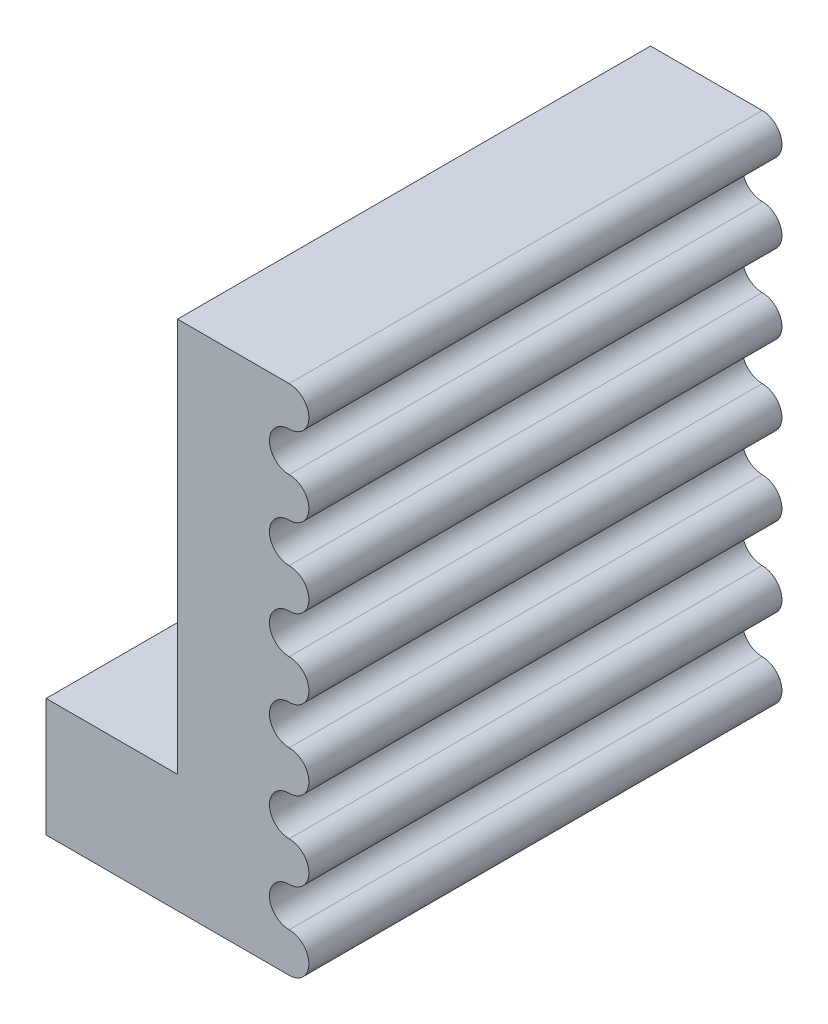
from build123d import *

# Parameters (mm, degrees)
EXTRUDE_1_DEPTH = 18


with BuildPart() as part:
    # 草图1 → 凸台-拉伸1 (new body)
    with BuildSketch(Plane.XY):
        with BuildLine():
            Line((5, 4.5), (5, 19.5))
            Line((5, 19.5), (9.25, 19.5))
            ThreePointArc((9.25, 19.5), (10, 18.75), (9.25, 18))
            ThreePointArc((9.25, 18), (8.5, 17.25), (9.25, 16.5))
            ThreePointArc((9.25, 16.5), (10, 15.75), (9.25, 15))
            ThreePointArc((9.25, 15), (8.5, 14.25), (9.25, 13.5))
            ThreePointArc((9.25, 13.5), (10, 12.75), (9.25, 12))
            ThreePointArc((9.25, 12), (8.5, 11.25), (9.25, 10.5))
            ThreePointArc((9.25, 10.5), (10, 9.75), (9.25, 9))
            ThreePointArc((9.25, 9), (8.5, 8.25), (9.25, 7.5))
            ThreePointArc((9.25, 7.5), (10, 6.75), (9.25, 6))
            ThreePointArc((9.25, 6), (8.5, 5.25), (9.25, 4.5))
            ThreePointArc((9.25, 4.5), (10, 3.75), (9.25, 3))
            ThreePointArc((9.25, 3), (8.5, 2.25), (9.25, 1.5))
            ThreePointArc((9.25, 1.5), (10, 0.75), (9.25, 0))
            Line((9.25, 0), (0, 0))
            Line((0, 0), (0, 4.5))
            Line((0, 4.5), (5, 4.5))
        make_face()
    extrude(amount=EXTRUDE_1_DEPTH)


solid = part.part
